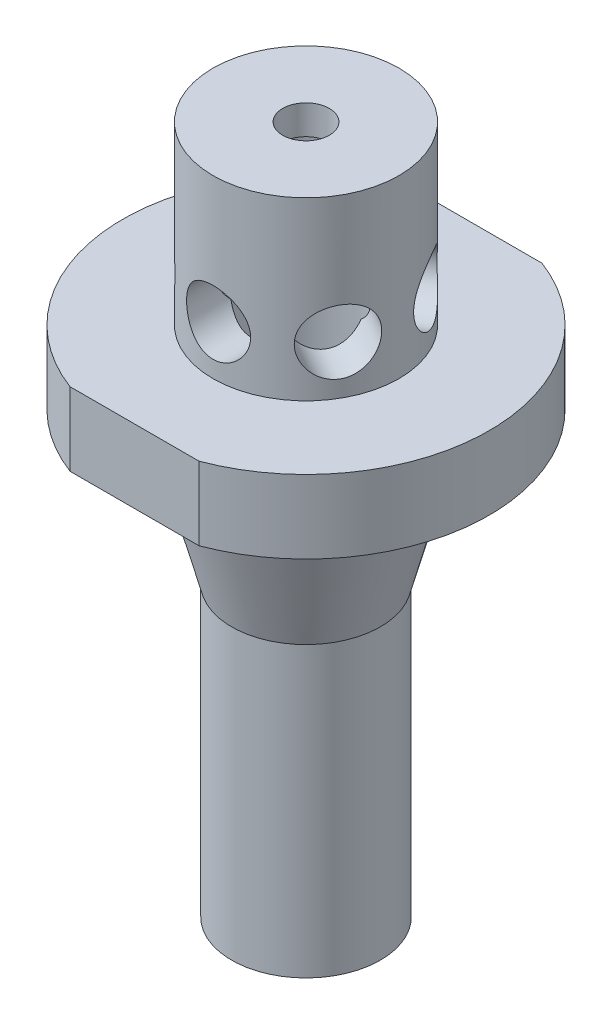
from build123d import *

# Parameters (mm, degrees)
SKETCH5_R          = 7.5
CUT_EXTRUDE1_DEPTH = 90
SKETCH6_R          = 4.370407338
CUT_EXTRUDE2_DEPTH = 20
CIRPATTERN1_COUNT  = 6
CUT_EXTRUDE3_REACH = 80.422
SKETCH11_R         = 3.18
CUT_EXTRUDE4_DEPTH = 101.042790939


with BuildPart() as part:
    # Sketch1 → Revolve1 (revolve)
    with BuildSketch(Plane(origin=(0, 0, 0), x_dir=(0, 0, -1), z_dir=(1, 0, 0))):
        Polygon((0, 34), (12.7, 34), (12.7, 10), (25, 10), (25, 0), (15.68, 0), (10.16, -20.600920458), (10.16, -60), (0, -60), align=None)
    revolve(axis=Axis((0, 0, 0), (0, 1, 0)))

    # Sketch5 → Cut-Extrude1 (cut)
    with BuildSketch(Plane.XZ.offset(60)):
        with Locations(Location((0, 0, 0), (0, 0, 270))):
            Circle(SKETCH5_R)
    extrude(amount=-CUT_EXTRUDE1_DEPTH, mode=Mode.SUBTRACT)

    # Sketch6 → Cut-Extrude2 (cut, symmetric)
    with BuildSketch(Plane.XY):
        with Locations((0, 16.659966967)):
            Circle(SKETCH6_R)
    cut_extrude2 = extrude(amount=CUT_EXTRUDE2_DEPTH, both=True, mode=Mode.SUBTRACT)

    # CirPattern1: Cut-Extrude2 ×6 about axis
    cirpattern1_axis = Axis((0, 34, 0), (0, -1, 0))
    for i in range(1, CIRPATTERN1_COUNT):
        add(cut_extrude2.rotate(cirpattern1_axis, i * 360 / CIRPATTERN1_COUNT), mode=Mode.SUBTRACT)

    # Sketch8 → Cut-Extrude3 (cut, up to next)
    with BuildSketch(Plane(origin=(0, 10, 0), x_dir=(1, 0, 0), z_dir=(0, 1, 0)), mode=Mode.PRIVATE) as cut_extrude3_sk1:
        with BuildLine():
            Line((-8.863016009, 23.4), (8.863016009, 23.4))
            ThreePointArc((8.863016009, 23.4), (0, 25.022251153), (-8.863016009, 23.4))
        make_face()
    cut_extrude3_tool1 = extrude(cut_extrude3_sk1.sketch, amount=-CUT_EXTRUDE3_REACH, mode=Mode.PRIVATE) & part.part
    # Sketch8 → Cut-Extrude3 (cut, up to next)
    with BuildSketch(Plane(origin=(0, 10, 0), x_dir=(1, 0, 0), z_dir=(0, 1, 0)), mode=Mode.PRIVATE) as cut_extrude3_sk2:
        with BuildLine():
            Line((-8.863016009, -23.4), (8.863016009, -23.4))
            ThreePointArc((8.863016009, -23.4), (0, -25.022251153), (-8.863016009, -23.4))
        make_face()
    cut_extrude3_tool2 = extrude(cut_extrude3_sk2.sketch, amount=-CUT_EXTRUDE3_REACH, mode=Mode.PRIVATE) & part.part
    add(cut_extrude3_tool1.solids().sort_by_distance((0, 10, -24.050738))[0], mode=Mode.SUBTRACT)
    add(cut_extrude3_tool2.solids().sort_by_distance((0, 10, 24.050738))[0], mode=Mode.SUBTRACT)

    # Sketch11 → Cut-Extrude4 (cut, through all)
    with BuildSketch(Plane(origin=(0, 34, 0), x_dir=(1, 0, 0), z_dir=(0, 1, 0))):
        with Locations(Location((0, 0, 0), (0, 0, 270))):
            Circle(SKETCH11_R)
    extrude(amount=-CUT_EXTRUDE4_DEPTH, mode=Mode.SUBTRACT)


solid = part.part
